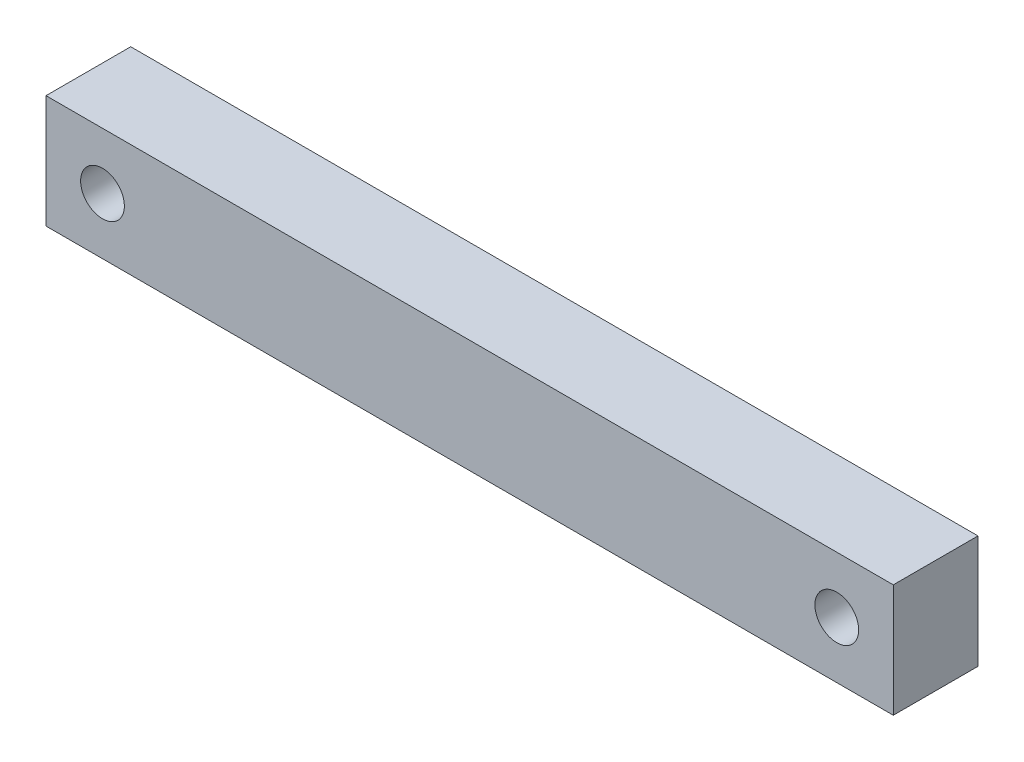
from build123d import *

# Parameters (mm, degrees)
SZKIC1_W                    = 60
SZKIC1_H                    = 8
SZKIC1_R                    = 1.55
DODANIE_WYCI_GNI_CIE1_DEPTH = 6


with BuildPart() as part:
    # Szkic1 → Dodanie-wyciągnięcie1 (new body)
    with BuildSketch(Plane.XY):
        with Locations((59, -175.103962956)):
            Rectangle(SZKIC1_W, SZKIC1_H)
        with Locations((85, -175.103962956)):
            Circle(SZKIC1_R, mode=Mode.SUBTRACT)
        with Locations((33, -175.103962956)):
            Circle(SZKIC1_R, mode=Mode.SUBTRACT)
    extrude(amount=DODANIE_WYCI_GNI_CIE1_DEPTH)


solid = part.part
